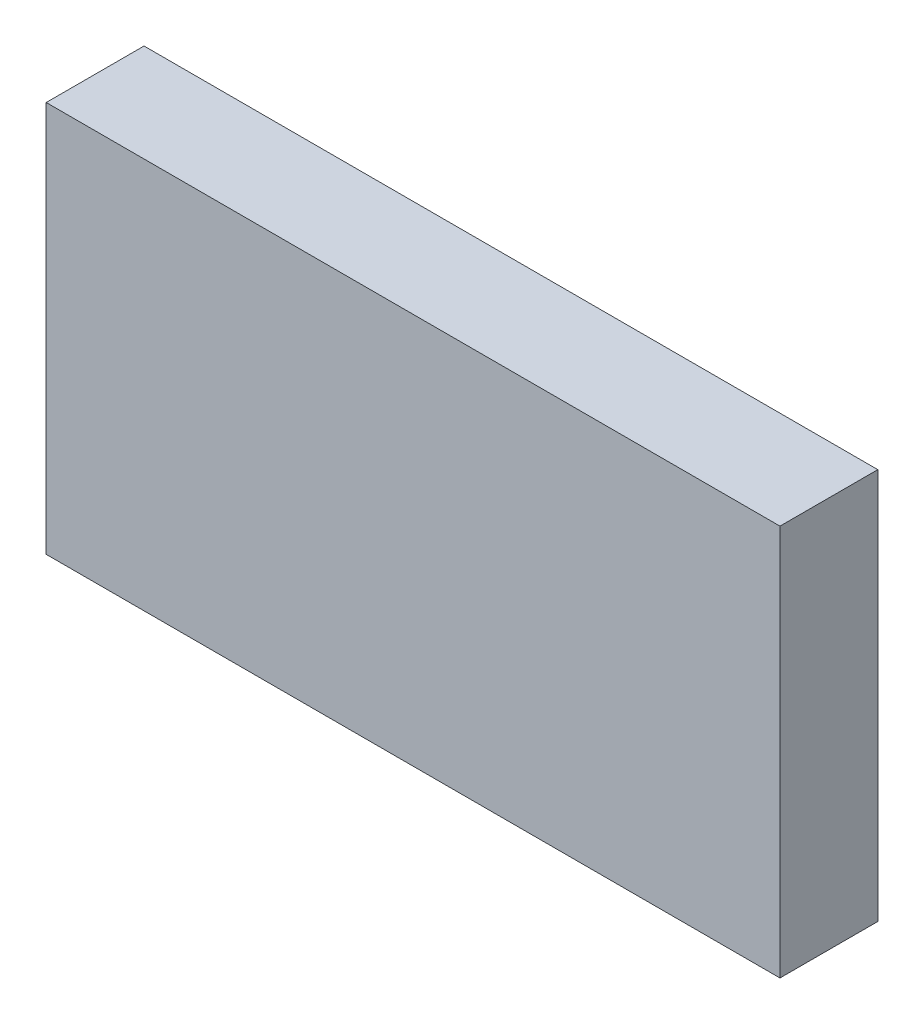
from build123d import *

# Parameters (mm, degrees)
SKETCH_1_W         = 15
SKETCH_1_H         = 8
BLOCKEXTRUDE_DEPTH = 2


with BuildPart() as part:
    # 草图1 → BlockExtrude (new body)
    with BuildSketch(Plane.XY):
        with Locations((7.5, 4)):
            Rectangle(SKETCH_1_W, SKETCH_1_H)
    extrude(amount=BLOCKEXTRUDE_DEPTH)


solid = part.part
